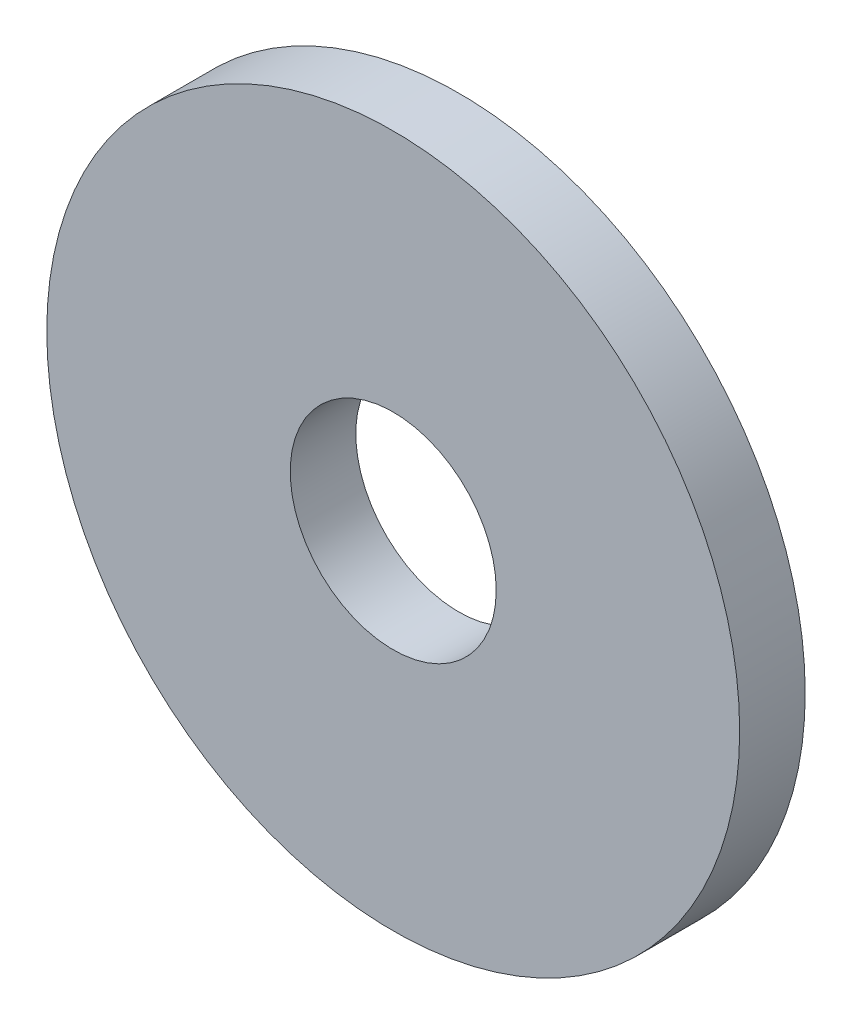
from build123d import *

# Parameters (mm, degrees)
SKETCH1_R           = 37
SKETCH1_R_2         = 11
BOSS_EXTRUDE1_DEPTH = 7


with BuildPart() as part:
    # Sketch1 → Boss-Extrude1 (new body)
    with BuildSketch(Plane.XY):
        Circle(SKETCH1_R)
        Circle(SKETCH1_R_2, mode=Mode.SUBTRACT)
    extrude(amount=BOSS_EXTRUDE1_DEPTH)


solid = part.part
